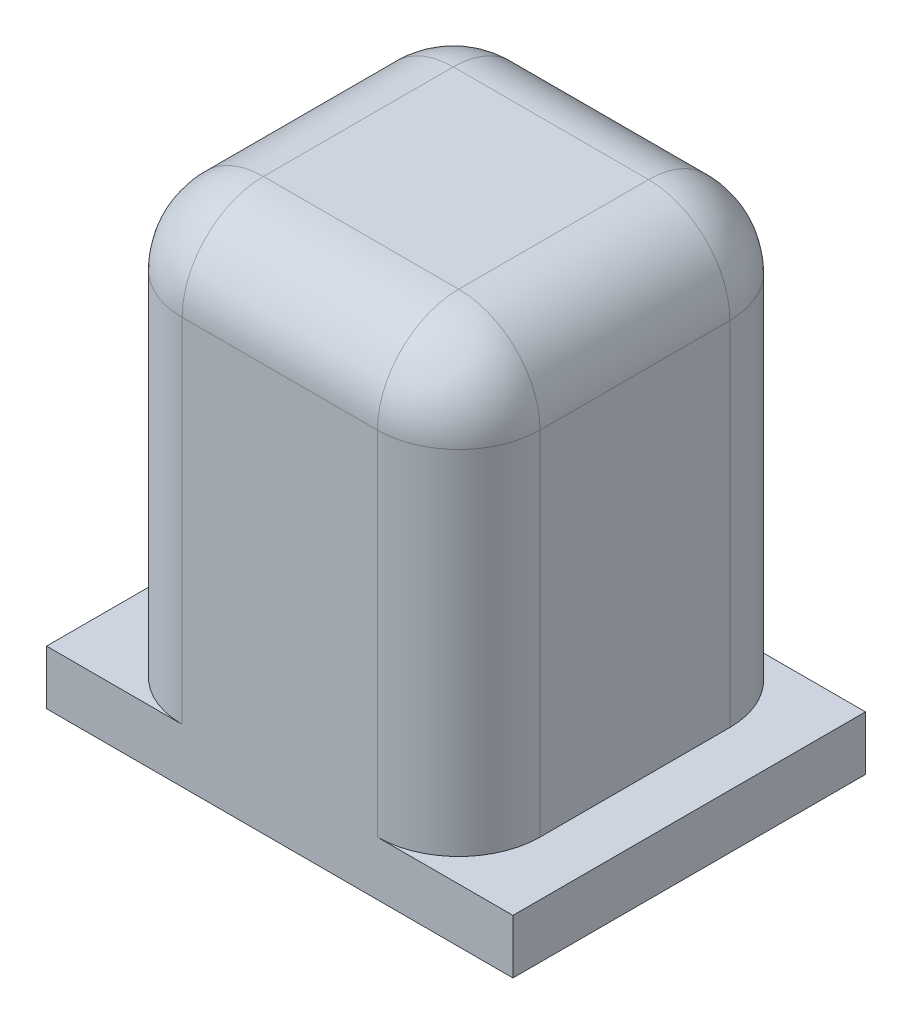
from build123d import *

# Parameters (mm, degrees)
SKETCH2_W           = 1
SKETCH2_H           = 1
BOSS_EXTRUDE1_DEPTH = 6.5
FILLET1_R           = 1.5


with BuildPart() as part:
    # Sketch2 → Boss-Extrude1 (new body)
    with BuildSketch(Plane.XY):
        with Locations((31.95, 48)):
            Rectangle(SKETCH2_W, SKETCH2_H)
        Polygon((35.75, 56.5), (32.45, 56.5), (32.45, 48.5), (32.45, 47.5), (35.75, 47.5), align=None)
        Polygon((39.05, 56.5), (35.75, 56.5), (35.75, 47.5), (39.05, 47.5), (39.05, 48.5), align=None)
        with Locations((39.55, 48)):
            Rectangle(SKETCH2_W, SKETCH2_H)
    extrude(amount=BOSS_EXTRUDE1_DEPTH)

    # Fillet1
    fillet1_edges = [part.edges().sort_by_distance(p)[0] for p in [
        (32.45, 52.5, 0),
        (35.75, 56.5, 0),
        (39.05, 52.5, 0),
        (32.45, 56.5, 3.25),
        (39.05, 56.5, 3.25),
        (39.05, 52.5, 6.5),
        (35.75, 56.5, 6.5),
        (32.45, 52.5, 6.5),
    ]]
    fillet(fillet1_edges, radius=FILLET1_R)


solid = part.part
